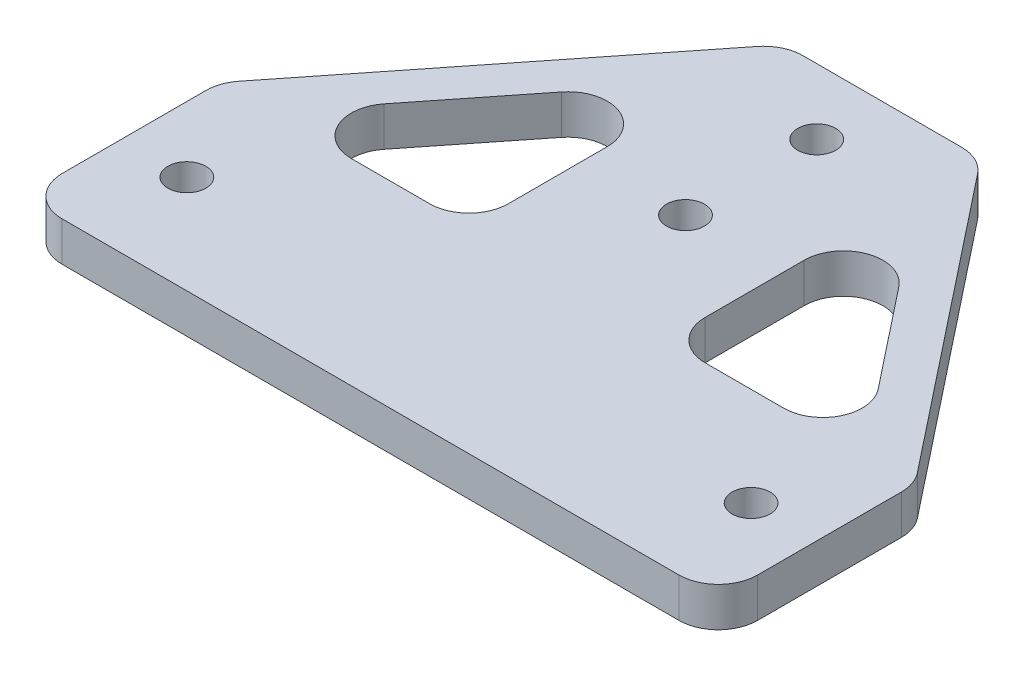
from build123d import *

# Parameters (mm, degrees)
SKETCH_1_R      = 1.45
EXTRUDE_1_DEPTH = 3
FILLET_2_R      = 3


with BuildPart() as part:
    # 草图1 → 凸台-拉伸1 (new body)
    with BuildSketch(Plane(origin=(0, 0, 0), x_dir=(1, 0, 0), z_dir=(0, 1, 0))):
        Polygon((7.5, 31.5), (26.5, 7.5), (26.5, -7.5), (-26.5, -7.5), (-26.5, 7.5), (-7.5, 31.5), align=None)
        with Locations(Location((0, 26.5, 0), (0, 0, 270))):
            Circle(SKETCH_1_R, mode=Mode.SUBTRACT)
        with Locations(Location((0, 16.5, 0), (0, 0, 270))):
            Circle(SKETCH_1_R, mode=Mode.SUBTRACT)
        with Locations(Location((21.5, 0, 0), (0, 0, 270))):
            Circle(SKETCH_1_R, mode=Mode.SUBTRACT)
        with Locations(Location((-21.5, 0, 0), (0, 0, 270))):
            Circle(SKETCH_1_R, mode=Mode.SUBTRACT)
        Polygon((-7.5, 7.5), (-7.5, 26.666770148), (-22.673693034, 7.5), align=None, mode=Mode.SUBTRACT)
        Polygon((22.673693034, 7.5), (7.5, 7.5), (7.5, 26.666770148), align=None, mode=Mode.SUBTRACT)
    extrude(amount=EXTRUDE_1_DEPTH)

    # 圆角2
    fillet_2_edges = [part.edges().sort_by_distance(p)[0] for p in [
        (22.673693034, 1.5, -7.5),
        (7.5, 1.5, -26.666770148),
        (7.5, 1.5, -7.5),
        (26.5, 1.5, -7.5),
        (26.5, 1.5, 7.5),
        (-26.5, 1.5, 7.5),
        (-26.5, 1.5, -7.5),
        (-7.5, 1.5, -31.5),
        (7.5, 1.5, -31.5),
        (-7.5, 1.5, -26.666770148),
        (-22.673693034, 1.5, -7.5),
        (-7.5, 1.5, -7.5),
    ]]
    fillet(fillet_2_edges, radius=FILLET_2_R)


solid = part.part
